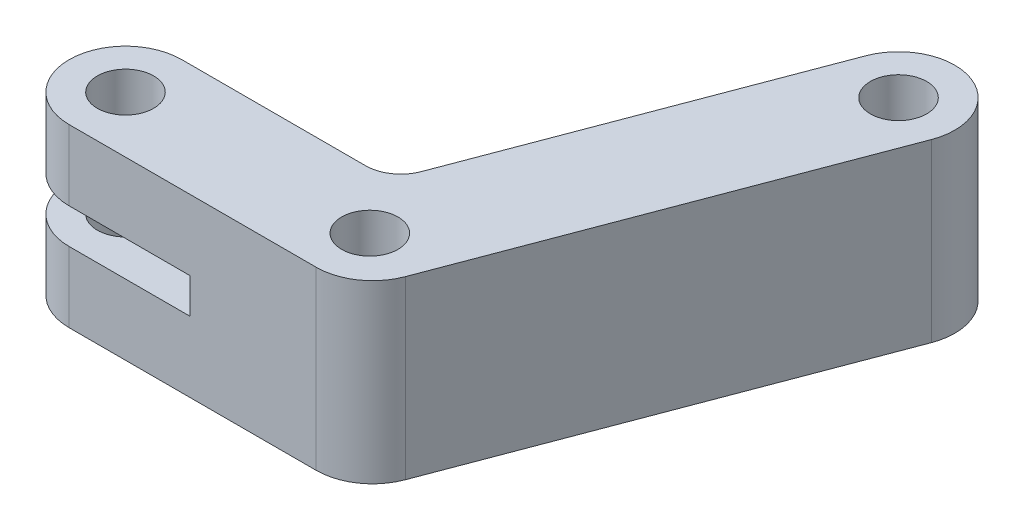
from build123d import *

# Parameters (mm, degrees)
SKETCH1_R           = 4
BOSS_EXTRUDE1_DEPTH = 25
SKETCH2_W           = 25.15
SKETCH2_H           = 5
CUT_EXTRUDE1_DEPTH  = 20


with BuildPart() as part:
    # Sketch1 → Boss-Extrude1 (new body)
    with BuildSketch(Plane(origin=(0, 0, 0), x_dir=(1, 0, 0), z_dir=(0, 1, 0))):
        with BuildLine():
            Line((0, 0), (35.106623938, 0))
            ThreePointArc((35.106623938, 0), (39.654705316, 1.418590137), (42.589820847, 5.171261055))
            Line((42.589820847, 5.171261055), (63.093196909, 59.411261055))
            ThreePointArc((63.093196909, 59.411261055), (58.438738945, 69.723196909), (48.126803091, 65.068738945))
            Line((48.126803091, 65.068738945), (30.799975774, 19.232038159))
            ThreePointArc((30.799975774, 19.232038159), (28.965528567, 16.886618836), (26.122977706, 16))
            Line((26.122977706, 16), (0, 16))
            ThreePointArc((0, 16), (-8, 8), (0, 0))
        make_face()
        with Locations(Location((0, 8, 0), (0, 0, 270))):
            Circle(SKETCH1_R, mode=Mode.SUBTRACT)
        with Locations(Location((55.61, 62.24, 0), (0, 0, 270))):
            Circle(SKETCH1_R, mode=Mode.SUBTRACT)
        with Locations(Location((34.72, 8, 0), (0, 0, 270))):
            Circle(SKETCH1_R, mode=Mode.SUBTRACT)
    extrude(amount=BOSS_EXTRUDE1_DEPTH)

    # Sketch2 → Cut-Extrude1 (cut)
    with BuildSketch(Plane.XY):
        with Locations((4.575, 12.5)):
            Rectangle(SKETCH2_W, SKETCH2_H)
    extrude(amount=-CUT_EXTRUDE1_DEPTH, mode=Mode.SUBTRACT)


solid = part.part
